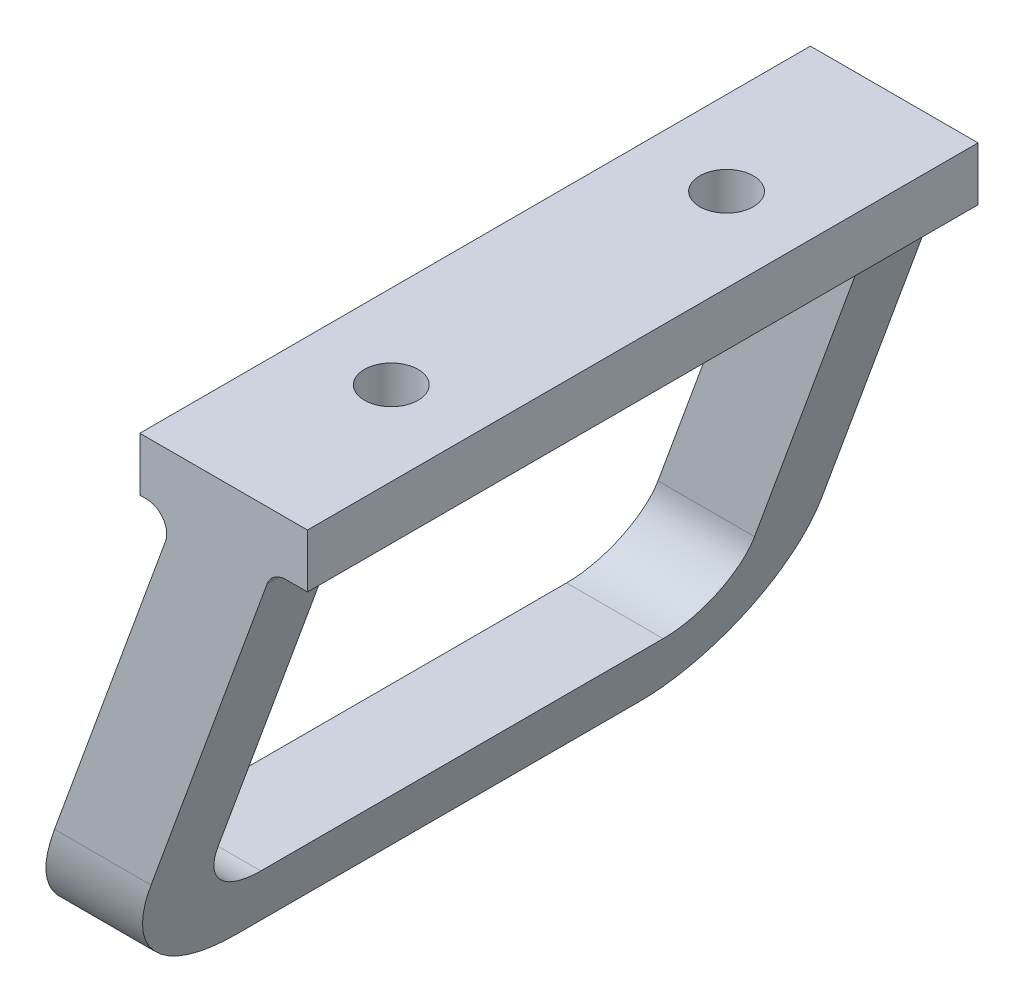
from build123d import *

# Parameters (mm, degrees)
BOSS_EXTRUDE1_DEPTH     = 50
CUT_EXTRUDE1_DEPTH      = 92.586319753
CUT_EXTRUDE1_DEPTH_BACK = 92.586319753
CUT_EXTRUDE2_DEPTH      = 98.796895786
CUT_EXTRUDE2_DEPTH_BACK = 15
SKETCH3_R               = 4


with BuildPart() as part:
    # Sketch1 → Boss-Extrude1 (new, symmetric)
    with BuildSketch(Plane.XY):
        with BuildLine():
            Line((-11.48444402, 0), (-12.5, 0))
            Line((-12.5, 0), (-12.5, 8))
            Line((-12.5, 8), (12.5, 8))
            Line((12.5, 8), (12.5, 0))
            Line((12.5, 0), (9.300622615, 0))
            ThreePointArc((9.300622615, 0), (7.579893306, -0.542543867), (6.481544752, -1.97393957))
            Line((6.481544752, -1.97393957), (-18.1, -69.511178712))
            Line((-18.1, -69.511178712), (-32.5, -69.511178712))
            Line((-32.5, -69.511178712), (-8.665366158, -4.02606043))
            ThreePointArc((-8.665366158, -4.02606043), (-9.026987887, -1.279270691), (-11.48444402, 0))
        make_face()
    extrude(amount=BOSS_EXTRUDE1_DEPTH, both=True)

    # Sketch2 → Cut-Extrude1 (cut, two sides: drawn at the far end of the back side and taken through both)
    with BuildSketch(Plane(origin=(0, 0, 0), x_dir=(0, 0, -1), z_dir=(1, 0, 0)).offset(-CUT_EXTRUDE1_DEPTH_BACK)):
        with BuildLine():
            Line((40, -7), (-40, -7))
            Line((-40, -7), (-40, -49.511178712))
            ThreePointArc((-40, -49.511178712), (-37.071067812, -56.582246524), (-30, -59.511178712))
            Line((-30, -59.511178712), (30, -59.511178712))
            ThreePointArc((30, -59.511178712), (37.071067812, -56.582246524), (40, -49.511178712))
            Line((40, -49.511178712), (40, -7))
        make_face()
        with BuildLine():
            Line((-50, -49.511178712), (-50, -69.511178712))
            Line((-50, -69.511178712), (-30, -69.511178712))
            ThreePointArc((-30, -69.511178712), (-44.142135624, -63.653314336), (-50, -49.511178712))
        make_face()
        with BuildLine():
            Line((50, -49.511178712), (50, -69.511178712))
            Line((50, -69.511178712), (30, -69.511178712))
            ThreePointArc((30, -69.511178712), (44.142135624, -63.653314336), (50, -49.511178712))
        make_face()
    extrude(amount=CUT_EXTRUDE1_DEPTH + CUT_EXTRUDE1_DEPTH_BACK, mode=Mode.SUBTRACT)

    # Sketch3 → Cut-Extrude2 (cut, two sides: drawn at the far end of the back side and taken through both)
    with BuildSketch(Plane(origin=(0, 8, 0), x_dir=(1, 0, 0), z_dir=(0, 1, 0)).offset(-CUT_EXTRUDE2_DEPTH_BACK)):
        with Locations(Location((0, -25, 0), (0, 0, 270))):
            Circle(SKETCH3_R)
        with Locations(Location((0, 25, 0), (0, 0, 270))):
            Circle(SKETCH3_R)
    extrude(amount=CUT_EXTRUDE2_DEPTH + CUT_EXTRUDE2_DEPTH_BACK, mode=Mode.SUBTRACT)


solid = part.part
